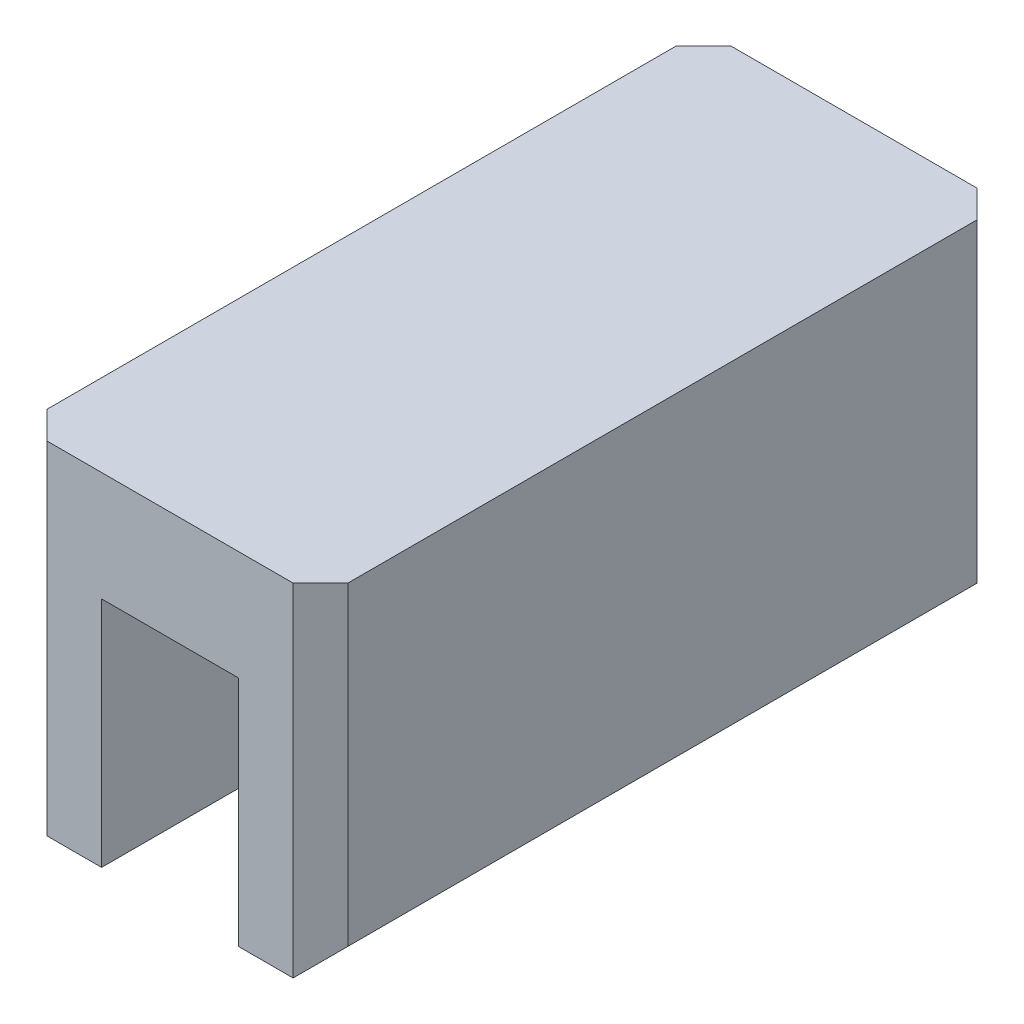
from build123d import *

# Parameters (mm, degrees)
ESTRUSIONE_ESTRUSIONE1_DEPTH = 50
SMUSSO1_SIZE                 = 2


with BuildPart() as part:
    # Schizzo1 → Estrusione-Estrusione1 (new body)
    with BuildSketch(Plane.XY):
        Polygon((5, 0), (-5, 0), (-5, -17), (-11, -17), (-11, 8), (11, 8), (11, -17), (5, -17), align=None)
    extrude(amount=ESTRUSIONE_ESTRUSIONE1_DEPTH)

    # Smusso1
    smusso1_edges = [part.edges().sort_by_distance(p)[0] for p in [
        (11, -4.5, 0),
        (11, -4.5, 50),
        (-11, -17, 25),
        (11, -17, 25),
        (-11, -4.5, 50),
        (-11, -4.5, 0),
    ]]
    chamfer(smusso1_edges, length=SMUSSO1_SIZE)


solid = part.part
